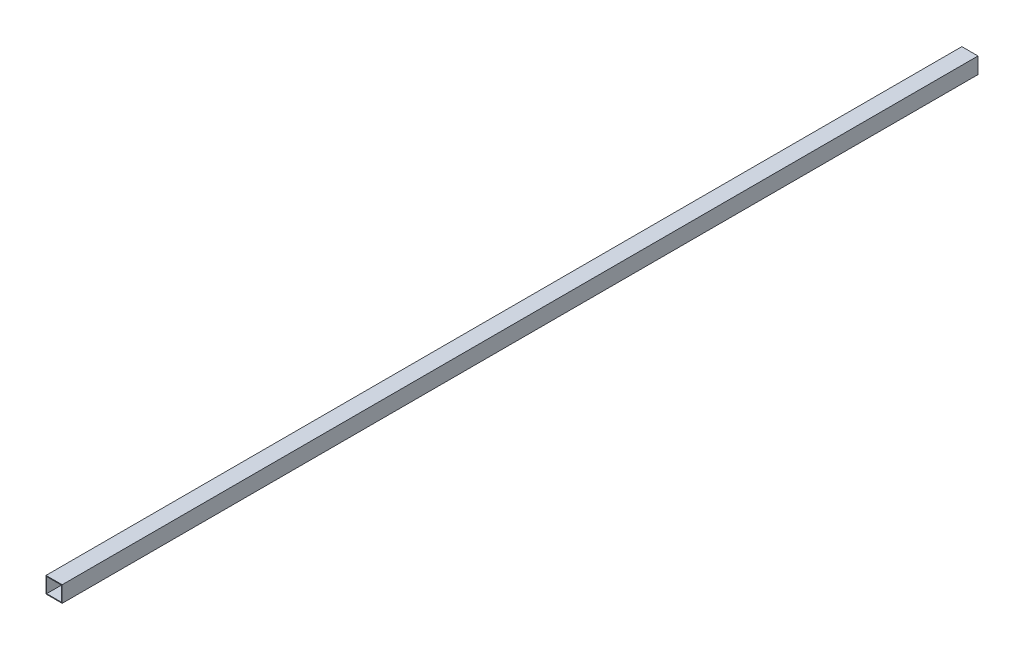
from build123d import *

# Parameters (mm, degrees)
SKETCH2_W           = 38.1
SKETCH2_H           = 38.1
SKETCH2_W_2         = 34.925
SKETCH2_H_2         = 34.925
BOSS_EXTRUDE1_DEPTH = 2159


with BuildPart() as part:
    # Sketch2 → Boss-Extrude1 (new body)
    with BuildSketch(Plane.XY):
        with Locations((19.05, 19.05)):
            Rectangle(SKETCH2_W, SKETCH2_H)
        with Locations((19.05, 19.05)):
            Rectangle(SKETCH2_W_2, SKETCH2_H_2, mode=Mode.SUBTRACT)
    extrude(amount=BOSS_EXTRUDE1_DEPTH)


solid = part.part
